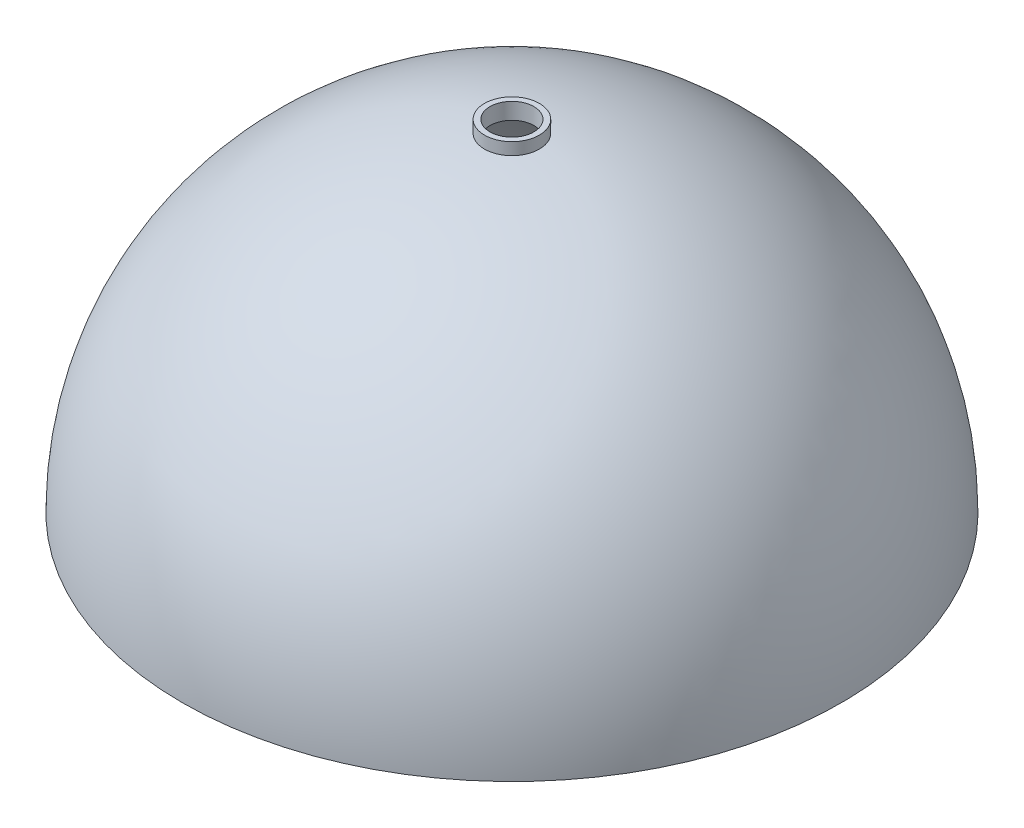
from build123d import *

# Parameters (mm, degrees)
SKETCH3_R           = 25
BOSS_EXTRUDE1_DEPTH = 310
SKETCH6_R           = 20
CUT_EXTRUDE2_DEPTH  = 330


with BuildPart() as part:
    # Sketch1 → Revolve1 (revolve)
    with BuildSketch(Plane.XY, mode=Mode.PRIVATE) as revolve1_sk:
        with BuildLine():
            Line((5, 0), (0, 0))
            ThreePointArc((0, 0), (87.867965644, 212.132034356), (300, 300))
            Line((300, 300), (300, 295))
            ThreePointArc((300, 295), (91.40349955, 208.59650045), (5, 0))
        make_face()
    revolve(revolve1_sk.sketch.rotate(Axis((300, 300, 0), (0, -1, 0)), 180), axis=Axis((300, 300, 0), (0, -1, 0)))

    # Sketch3 → Boss-Extrude1 (add)
    with BuildSketch(Plane(origin=(0, 0, 0), x_dir=(1, 0, 0), z_dir=(0, 1, 0))):
        with Locations(Location((300, 0, 0), (0, 0, 270))):
            Circle(SKETCH3_R)
    extrude(amount=BOSS_EXTRUDE1_DEPTH)

    # Sketch5 → Cut-Revolve1 (revolve, cut)
    with BuildSketch(Plane.XY, mode=Mode.PRIVATE) as cut_revolve1_sk:
        with BuildLine():
            Line((300.755316248, 295.755316248), (300.755316248, 0))
            Line((300.755316248, 0), (5, 0))
            ThreePointArc((5, 0), (91.624726557, 209.130589691), (300.755316248, 295.755316248))
        make_face()
    revolve(cut_revolve1_sk.sketch.rotate(Axis((300.755316248, 295.755316248, 0), (0, -1, 0)), 180), axis=Axis((300.755316248, 295.755316248, 0), (0, -1, 0)), mode=Mode.SUBTRACT)

    # Sketch6 → Cut-Extrude2 (cut)
    with BuildSketch(Plane(origin=(0, 310, 0), x_dir=(1, 0, 0), z_dir=(0, 1, 0))):
        with Locations(Location((300, 0, 0), (0, 0, 270))):
            Circle(SKETCH6_R)
    extrude(amount=-CUT_EXTRUDE2_DEPTH, mode=Mode.SUBTRACT)


solid = part.part
